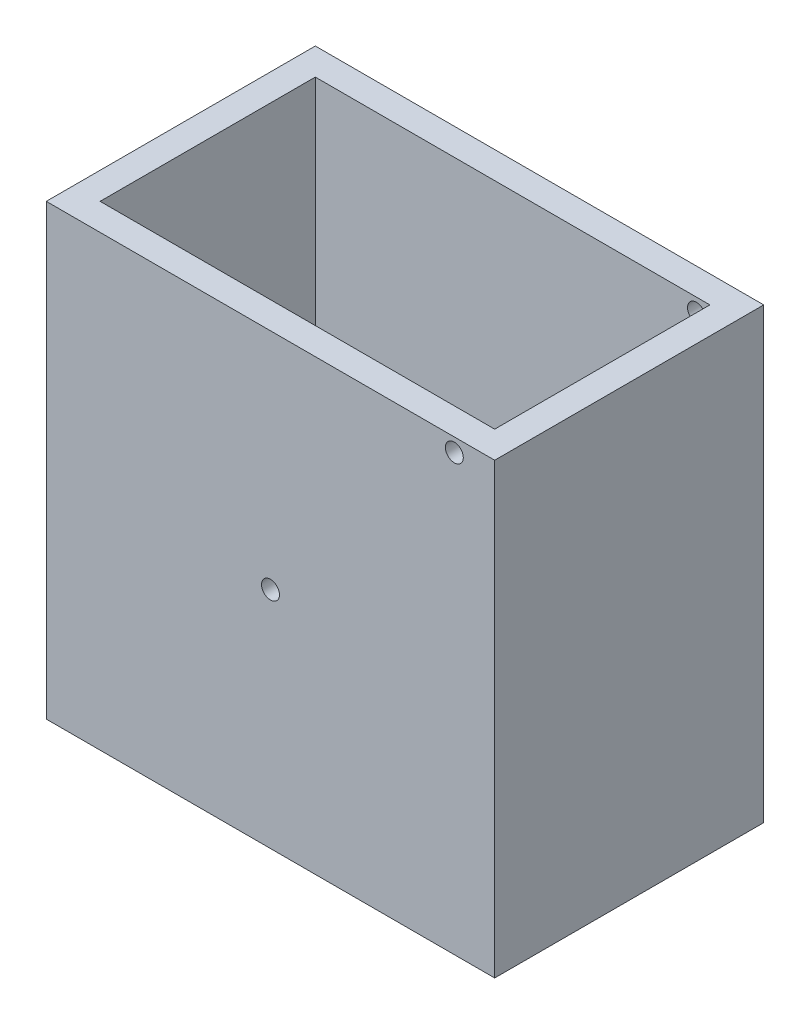
from build123d import *

# Parameters (mm, degrees)
SKETCH1_W           = 250
SKETCH1_H           = 250
BOSS_EXTRUDE1_DEPTH = 150
SKETCH2_W           = 220
SKETCH2_H           = 120
CUT_EXTRUDE1_DEPTH  = 235
SKETCH3_R           = 5
CUT_EXTRUDE5_DEPTH  = 235


with BuildPart() as part:
    # Sketch1 → Boss-Extrude1 (new body)
    with BuildSketch(Plane.XY):
        with Locations((125, -125)):
            Rectangle(SKETCH1_W, SKETCH1_H)
    extrude(amount=BOSS_EXTRUDE1_DEPTH)

    # Sketch2 → Cut-Extrude1 (cut)
    with BuildSketch(Plane(origin=(0, 0, 0), x_dir=(1, 0, 0), z_dir=(0, 1, 0))):
        with Locations((125, -75)):
            Rectangle(SKETCH2_W, SKETCH2_H)
    extrude(amount=-CUT_EXTRUDE1_DEPTH, mode=Mode.SUBTRACT)

    # Sketch3 → Cut-Extrude5 (cut)
    with BuildSketch(Plane.XY.offset(150)):
        with Locations((125, -125)):
            Circle(SKETCH3_R)
        with Locations((227.5, -7.5)):
            Circle(SKETCH3_R)
    extrude(amount=-CUT_EXTRUDE5_DEPTH, mode=Mode.SUBTRACT)


solid = part.part
